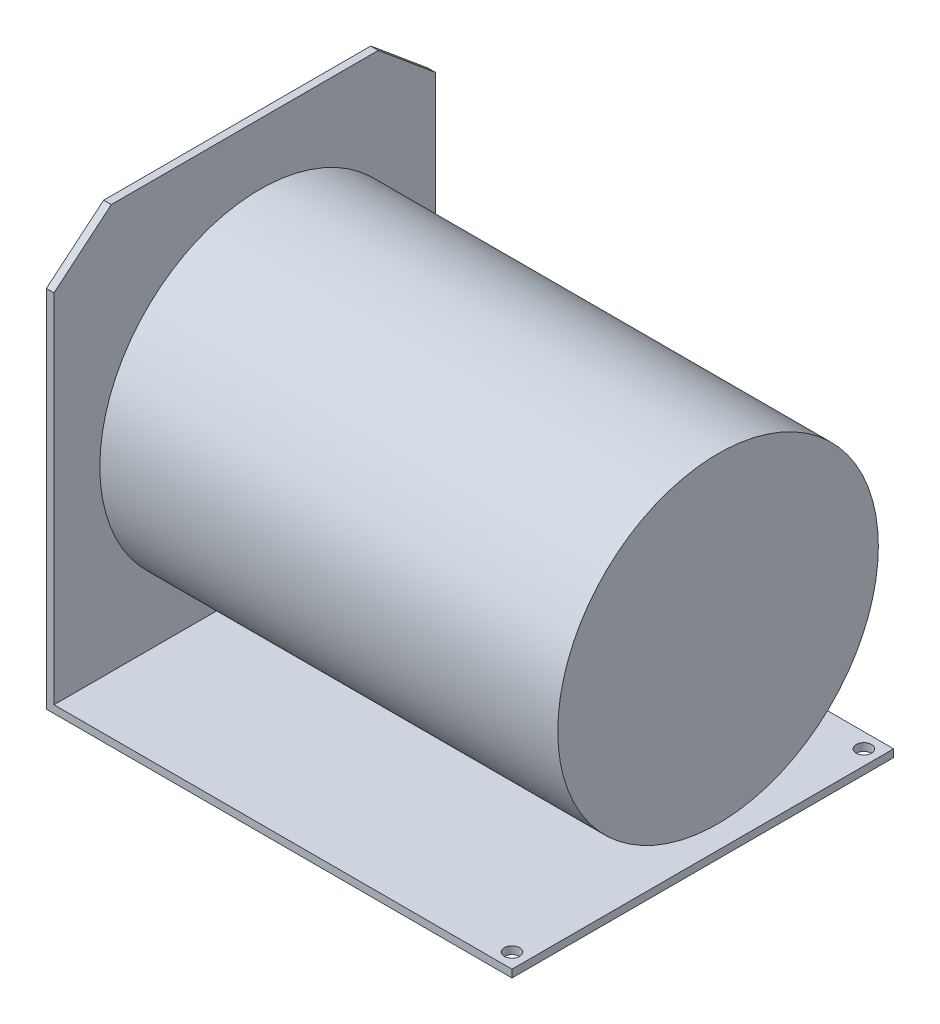
from build123d import *

# Parameters (mm, degrees)
ESQUISSE1_R             = 10.5
BOSS_EXTRU_1_DEPTH      = 30
ESQUISSE2_R             = 6
BOSS_EXTRU_2_DEPTH      = 1
ESQUISSE3_W             = 25
ESQUISSE3_H             = 27
BOSS_EXTRU_3_DEPTH      = 0.5
ESQUISSE4_W             = 25
ESQUISSE4_H             = 0.5
BOSS_EXTRU_4_DEPTH      = 30
ESQUISSE5_R             = 0.5
ENL_V_MAT_EXTRU_1_DEPTH = 30
ENL_V_MAT_EXTRU_2_DEPTH = 30
ESQUISSE7_R             = 1
BOSS_EXTRU_5_DEPTH      = 8


with BuildPart() as part:
    # Esquisse1 → Boss.-Extru.1 (new body)
    with BuildSketch(Plane(origin=(0, 0, 0), x_dir=(0, 0, -1), z_dir=(1, 0, 0))):
        Circle(ESQUISSE1_R)
    extrude(amount=BOSS_EXTRU_1_DEPTH)

    # Esquisse2 → Boss.-Extru.2 (add)
    with BuildSketch(Plane.ZY):
        Circle(ESQUISSE2_R)
    extrude(amount=BOSS_EXTRU_2_DEPTH)


with BuildPart() as body_2:
    # Esquisse3 → Boss.-Extru.3 (new body)
    with BuildSketch(Plane.ZY.offset(1)):
        Rectangle(ESQUISSE3_W, ESQUISSE3_H)
    extrude(amount=BOSS_EXTRU_3_DEPTH)

    # Esquisse4 → Boss.-Extru.4 (add)
    with BuildSketch(Plane(origin=(-1, 0, 0), x_dir=(0, 0, -1), z_dir=(1, 0, 0))):
        with Locations((0, -13.25)):
            Rectangle(ESQUISSE4_W, ESQUISSE4_H)
    extrude(amount=BOSS_EXTRU_4_DEPTH)

    # Esquisse5 → Enlèv. mat.-Extru.1 (cut)
    with BuildSketch(Plane.XZ.offset(13.5)):
        with Locations(Location((28.028049864, 11.525997246, 0), (0, 0, 270))):
            Circle(ESQUISSE5_R)
    enl_v_mat_extru_1 = extrude(amount=-ENL_V_MAT_EXTRU_1_DEPTH, mode=Mode.SUBTRACT)

    # Symétrie1: Enlèv. mat.-Extru.1 across plane
    add(enl_v_mat_extru_1.mirror(Plane.XY), mode=Mode.SUBTRACT)

    # Esquisse6 → Enlèv. mat.-Extru.2 (cut)
    with BuildSketch(Plane.ZY.offset(1.5)):
        Polygon((8.746033001, 13.5), (12.5, 10.372361451), (12.5, 13.5), align=None)
    enl_v_mat_extru_2 = extrude(amount=-ENL_V_MAT_EXTRU_2_DEPTH, mode=Mode.SUBTRACT)

    # Symétrie2: Enlèv. mat.-Extru.2 across plane
    add(enl_v_mat_extru_2.mirror(Plane.XY), mode=Mode.SUBTRACT)

    # Esquisse7 → Boss.-Extru.5 (add)
    with BuildSketch(Plane.ZY.offset(1.5)):
        Circle(ESQUISSE7_R)
    extrude(amount=BOSS_EXTRU_5_DEPTH)


solid = Compound([part.part, body_2.part])
